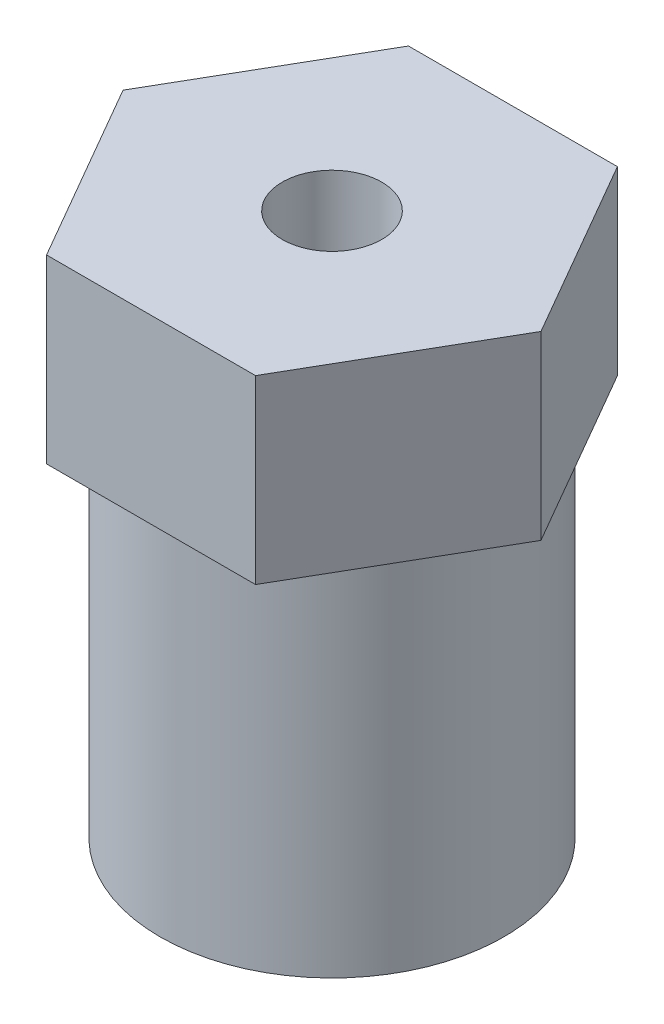
from build123d import *

# Parameters (mm, degrees)
SKETCH1_R           = 5.7
SKETCH1_R_2         = 2.55
BOSS_EXTRUDE1_DEPTH = 12
SKETCH2_R           = 1.65
BOSS_EXTRUDE2_DEPTH = 6


with BuildPart() as part:
    # Sketch1 → Boss-Extrude1 (new body)
    with BuildSketch(Plane(origin=(0, 0, 0), x_dir=(1, 0, 0), z_dir=(0, 1, 0))):
        with Locations(Location((0, 0, 0), (0, 0, 270))):
            Circle(SKETCH1_R)
        with Locations(Location((0, 0, 0), (0, 0, 270))):
            Circle(SKETCH1_R_2, mode=Mode.SUBTRACT)
    extrude(amount=BOSS_EXTRUDE1_DEPTH)

    # Sketch2 → Boss-Extrude2 (add)
    with BuildSketch(Plane(origin=(0, 12, 0), x_dir=(1, 0, 0), z_dir=(0, 1, 0))):
        Polygon((6.92820323, 0), (3.464101615, 6), (-3.464101615, 6), (-6.92820323, 0), (-3.464101615, -6), (3.464101615, -6), align=None)
        with Locations(Location((0, 0, 0), (0, 0, 270))):
            Circle(SKETCH2_R, mode=Mode.SUBTRACT)
    extrude(amount=BOSS_EXTRUDE2_DEPTH)


solid = part.part
